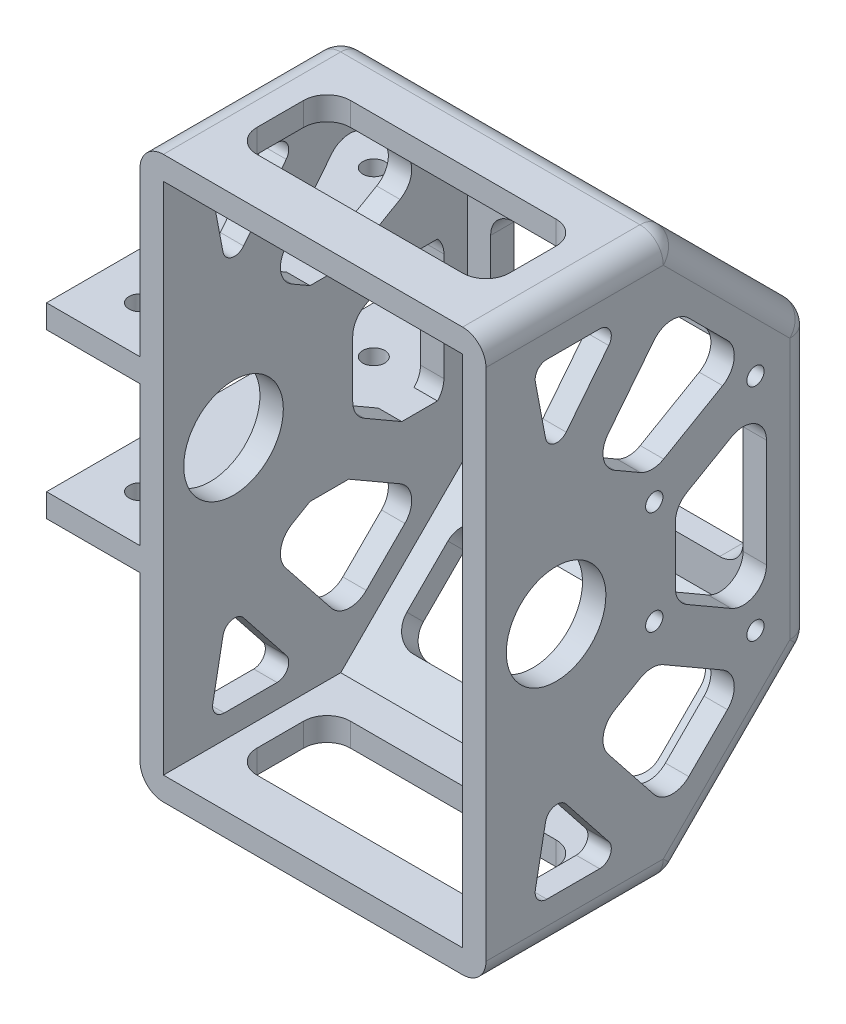
from build123d import *

# Parameters (mm, degrees)
SKETCH_1_W           = 74
SKETCH_1_H           = 120
EXTRUDE_1_DEPTH      = 70
CHAMFER_2_SIZE       = 30
SHELL_1_T            = -5
SKETCH_2_R           = 10.65
CUT_EXTRUDE_1_DEPTH  = 119.220133649
SKETCH_3_W           = 54
SKETCH_3_H           = 22.426406871
CUT_EXTRUDE_2_DEPTH  = 70
SKETCH_4_W           = 54
SKETCH_4_H           = 22.426406871
CUT_EXTRUDE_3_DEPTH  = 70
SKETCH_5_W           = 54
SKETCH_5_H           = 40
CUT_EXTRUDE_4_DEPTH  = 70
SKETCH_7_W           = 54
SKETCH_7_H           = 20
CUT_EXTRUDE_5_DEPTH  = 144.767172887
FILLET_1_R           = 5
EXTRUDE_3_DEPTH      = 20
EXTRUDE_3_DEPTH_BACK = 5
SKETCH_10_W          = 70
SKETCH_10_H          = 5
SKETCH_12_R          = 2.35
CUT_EXTRUDE_7_DEPTH  = 121.619235614
SKETCH_13_R          = 1.85
CUT_EXTRUDE_8_DEPTH  = 10
FILLET_2_R           = 2.5


with BuildPart() as part:
    # ｽｹｯﾁ1 → ﾎﾞｽ - 押し出し1 (new body)
    with BuildSketch(Plane.XY):
        Rectangle(SKETCH_1_W, SKETCH_1_H)
    extrude(amount=EXTRUDE_1_DEPTH)

    # 面取り2
    chamfer_2_edges = [part.edges().sort_by_distance(p)[0] for p in [
        (0, -60, 0),
        (0, 60, 0),
    ]]
    chamfer(chamfer_2_edges, length=CHAMFER_2_SIZE)

    # ｼｪﾙ1
    shell_1_openings = [part.faces().sort_by_distance(p)[0] for p in [
        (0, 0, 70),
    ]]
    offset(amount=SHELL_1_T, openings=shell_1_openings, kind=Kind.INTERSECTION)

    # ｽｹｯﾁ2 → ｶｯﾄ - 押し出し1 (cut, through all)
    with BuildSketch(Plane.ZY.offset(37)):
        Polygon((56.233448956, -30.166367483), (40.521006785, -50), (60, -50), align=None)
        Polygon((30.582918816, -46.440783192), (47.484677526, -25.105890275), (34.5, -17.60918321), (13.738168081, -29.596032457), align=None)
        with Locations(Location((55, 0, 0), (0, 0, 270))):
            Circle(SKETCH_2_R)
        Polygon((34.5, 17.60918321), (47.484677526, 25.105890275), (30.582918816, 46.440783192), (13.738168081, 29.596032457), align=None)
        Polygon((10, 20.207259422), (10, -20.207259422), (29.5, -8.948929172), (29.5, 8.948929172), align=None)
        Polygon((56.233448956, 30.166367483), (60, 50), (40.521006785, 50), align=None)
    extrude(amount=-CUT_EXTRUDE_1_DEPTH, mode=Mode.SUBTRACT)

    # ｽｹｯﾁ3 → ｶｯﾄ - 押し出し2 (cut)
    with BuildSketch(Plane(origin=(0, -15, -15), x_dir=(1, 0, 0), z_dir=(0, -0.7071067811865464, -0.7071067811865487))):
        with Locations((0, 42.426406872)):
            Rectangle(SKETCH_3_W, SKETCH_3_H)
    extrude(amount=-CUT_EXTRUDE_2_DEPTH, mode=Mode.SUBTRACT)

    # ｽｹｯﾁ4 → ｶｯﾄ - 押し出し3 (cut)
    with BuildSketch(Plane(origin=(0, 15, -15), x_dir=(1, 0, 0), z_dir=(0, 0.7071067811865464, -0.7071067811865487))):
        with Locations((0, -42.426406872)):
            Rectangle(SKETCH_4_W, SKETCH_4_H)
    extrude(amount=-CUT_EXTRUDE_3_DEPTH, mode=Mode.SUBTRACT)

    # ｽｹｯﾁ5 → ｶｯﾄ - 押し出し4 (cut)
    with BuildSketch(Plane(origin=(0, 0, 0), x_dir=(-1, 0, 0), z_dir=(0, 0, -1))):
        Rectangle(SKETCH_5_W, SKETCH_5_H)
    extrude(amount=-CUT_EXTRUDE_4_DEPTH, mode=Mode.SUBTRACT)

    # ｽｹｯﾁ7 → ｶｯﾄ - 押し出し5 (cut, through all)
    with BuildSketch(Plane(origin=(0, 60, 0), x_dir=(1, 0, 0), z_dir=(0, 1, 0))):
        with Locations((0, -50)):
            Rectangle(SKETCH_7_W, SKETCH_7_H)
    extrude(amount=-CUT_EXTRUDE_5_DEPTH, mode=Mode.SUBTRACT)

    # ﾌｨﾚｯﾄ1
    fillet_1_edges = [part.edges().sort_by_distance(p)[0] for p in [
        (34.5, 20.207259422, 10),
        (34.5, 8.948929172, 29.5),
        (34.5, -8.948929172, 29.5),
        (34.5, -20.207259422, 10),
        (-34.5, 20.207259422, 10),
        (-34.5, 8.948929172, 29.5),
        (-34.5, -8.948929172, 29.5),
        (-34.5, -20.207259422, 10),
        (34.5, 46.440783192, 30.582918816),
        (34.5, 25.105890275, 47.484677526),
        (34.5, 17.60918321, 34.5),
        (34.5, 29.596032457, 13.738168081),
        (-34.5, 46.440783192, 30.582918816),
        (-34.5, 25.105890275, 47.484677526),
        (-34.5, 17.60918321, 34.5),
        (-34.5, 29.596032457, 13.738168081),
        (0, 60, 30),
        (-37, 0, 0),
        (-37, -45, 15),
        (-37, 45, 15),
        (37, 0, 0),
        (0, -30, 0),
        (0, 30, 0),
        (-27, -51.161165235, 24.696699141),
        (27, -51.161165235, 24.696699141),
        (27, -35.303300859, 8.838834765),
        (-27, -35.303300859, 8.838834765),
        (37, -45, 15),
        (37, 45, 15),
        (0, -60, 30),
        (27, 51.161165235, 24.696699141),
        (-27, 51.161165235, 24.696699141),
        (-27, 35.303300859, 8.838834765),
        (27, 35.303300859, 8.838834765),
        (-27, -20, 2.5),
        (27, -20, 2.5),
        (27, 20, 2.5),
        (-27, 20, 2.5),
        (27, 57.5, 60),
        (-27, 57.5, 60),
        (-27, 57.5, 40),
        (27, 57.5, 40),
        (27, -57.5, 60),
        (-27, -57.5, 60),
        (-27, -57.5, 40),
        (27, -57.5, 40),
        (34.5, -29.596032457, 13.738168081),
        (34.5, -17.60918321, 34.5),
        (34.5, -25.105890275, 47.484677526),
        (34.5, -46.440783192, 30.582918816),
        (-34.5, -29.596032457, 13.738168081),
        (-34.5, -17.60918321, 34.5),
        (-34.5, -25.105890275, 47.484677526),
        (-34.5, -46.440783192, 30.582918816),
        (37, -60, 50),
        (-37, -60, 50),
        (-37, 60, 50),
        (37, 60, 50),
    ]]
    fillet(fillet_1_edges, radius=FILLET_1_R)

    # ｽｹｯﾁ10 → ﾎﾞｽ - 押し出し3 (add, two sides: drawn at the far end of the back side and taken through both)
    with BuildSketch(Plane.ZY.offset(37).offset(-EXTRUDE_3_DEPTH_BACK)):
        with Locations((35, 17.5)):
            Rectangle(SKETCH_10_W, SKETCH_10_H)
        with Locations((35, -17.5)):
            Rectangle(SKETCH_10_W, SKETCH_10_H)
    extrude(amount=EXTRUDE_3_DEPTH + EXTRUDE_3_DEPTH_BACK)

    # ｽｹｯﾁ12 → ｶｯﾄ - 押し出し7 (cut, through all)
    with BuildSketch(Plane.XZ.offset(20)):
        with Locations((-47, 60)):
            Circle(SKETCH_12_R)
        with Locations((-47, 10)):
            Circle(SKETCH_12_R)
    extrude(amount=-CUT_EXTRUDE_7_DEPTH, mode=Mode.SUBTRACT)

    # ｽｹｯﾁ13 → ｶｯﾄ - 押し出し8 (cut)
    with BuildSketch(Plane(origin=(37, 0, 0), x_dir=(0, 0, -1), z_dir=(1, 0, 0))):
        with Locations(Location((-12.349364905, 24.624355653, 0), (0, 0, 90))):
            Circle(SKETCH_13_R)
        with Locations(Location((-34, 12.124355653, 0), (0, 0, 90))):
            Circle(SKETCH_13_R)
        with Locations(Location((-34, -10.011106999, 0), (0, 0, 90))):
            Circle(SKETCH_13_R)
        with Locations(Location((-12.349364905, -22.511106999, 0), (0, 0, 90))):
            Circle(SKETCH_13_R)
    extrude(amount=-CUT_EXTRUDE_8_DEPTH, mode=Mode.SUBTRACT)

    # ﾌｨﾚｯﾄ2
    fillet_2_edges = [part.edges().sort_by_distance(p)[0] for p in [
        (-34.5, -30.166367483, 56.233448956),
        (-34.5, -50, 60),
        (34.5, 30.166367483, 56.233448956),
        (34.5, 50, 40.521006785),
        (34.5, 50, 60),
        (-34.5, 30.166367483, 56.233448956),
        (-34.5, 50, 40.521006785),
        (-34.5, 50, 60),
        (34.5, -50, 40.521006785),
        (34.5, -30.166367483, 56.233448956),
        (34.5, -50, 60),
        (-34.5, -50, 40.521006785),
    ]]
    fillet(fillet_2_edges, radius=FILLET_2_R)


solid = part.part
